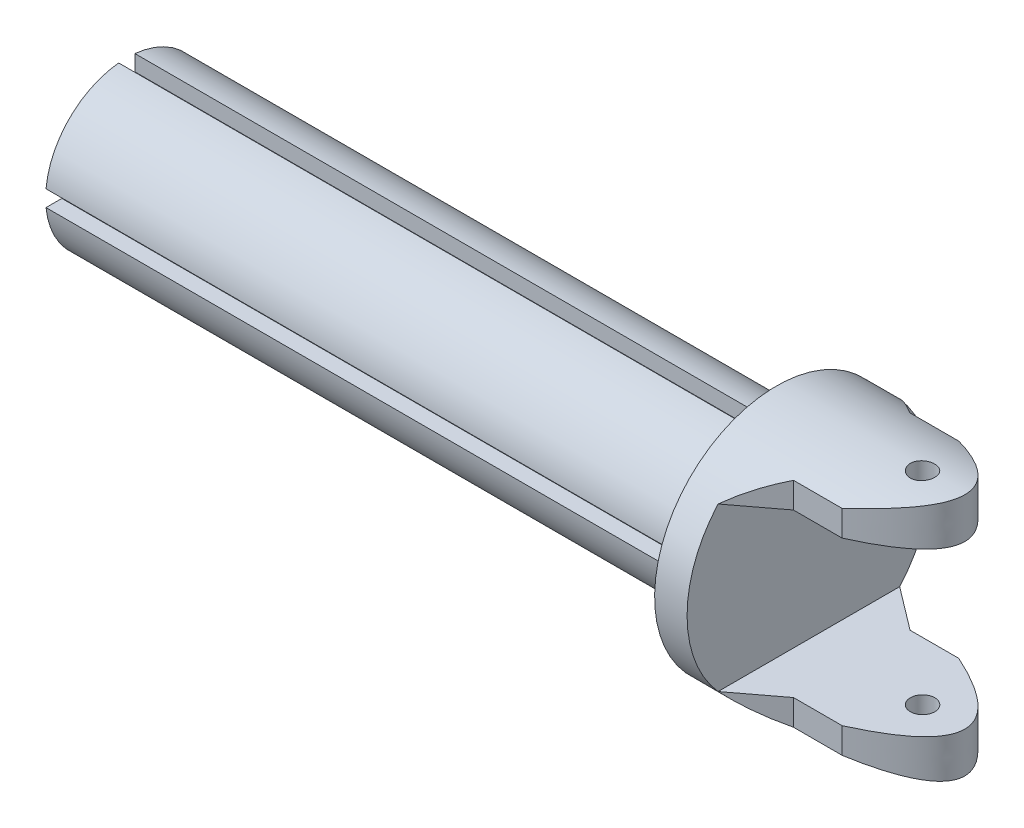
from build123d import *

# Parameters (mm, degrees)
BOSS_EXTRUDE1_DEPTH     = 40
SKETCH2_R               = 7.5
BOSS_EXTRUDE2_DEPTH     = 2
BOSS_EXTRUDE3_DEPTH     = 10
CUT_EXTRUDE1_DEPTH      = 55.004629431
CUT_EXTRUDE1_DEPTH_BACK = 55.004629431
CUT_EXTRUDE2_DEPTH      = 54.619586107
CUT_EXTRUDE2_DEPTH_BACK = 54.619586107
SKETCH5_R               = 0.75


with BuildPart() as part:
    # Sketch1 → Boss-Extrude1 (new body)
    with BuildSketch(Plane(origin=(0, 0, 0), x_dir=(0, 0, -1), z_dir=(1, 0, 0))):
        with BuildLine():
            Line((-0.5, 4), (0.5, 4))
            Line((0.5, 4), (0.5, 4.974937186))
            ThreePointArc((0.5, 4.974937186), (3.535533906, 3.535533906), (4.974937186, 0.5))
            Line((4.974937186, 0.5), (4, 0.5))
            Line((4, 0.5), (4, -0.5))
            Line((4, -0.5), (4.974937186, -0.5))
            ThreePointArc((4.974937186, -0.5), (3.535533906, -3.535533906), (0.5, -4.974937186))
            Line((0.5, -4.974937186), (0.5, -4))
            Line((0.5, -4), (-0.5, -4))
            Line((-0.5, -4), (-0.5, -4.974937186))
            ThreePointArc((-0.5, -4.974937186), (-3.535533906, -3.535533906), (-4.974937186, -0.5))
            Line((-4.974937186, -0.5), (-4, -0.5))
            Line((-4, -0.5), (-4, 0.5))
            Line((-4, 0.5), (-4.974937186, 0.5))
            ThreePointArc((-4.974937186, 0.5), (-3.535533906, 3.535533906), (-0.5, 4.974937186))
            Line((-0.5, 4.974937186), (-0.5, 4))
        make_face()
    extrude(amount=BOSS_EXTRUDE1_DEPTH)

    # Sketch2 → Boss-Extrude2 (add)
    with BuildSketch(Plane(origin=(40, 0, 0), x_dir=(0, 0, -1), z_dir=(1, 0, 0))):
        Circle(SKETCH2_R)
    extrude(amount=BOSS_EXTRUDE2_DEPTH)

    # Sketch3 → Boss-Extrude3 (add)
    with BuildSketch(Plane(origin=(42, 0, 0), x_dir=(0, 0, -1), z_dir=(1, 0, 0))):
        with BuildLine():
            ThreePointArc((5.590169944, 5), (0, 7.5), (-5.590169944, 5))
            Line((-5.590169944, 5), (-4.898979486, 5))
            Line((-4.898979486, 5), (4.898979486, 5))
            Line((4.898979486, 5), (5.590169944, 5))
        make_face()
        with BuildLine():
            Line((-4.898979486, -5), (-5.590169944, -5))
            ThreePointArc((-5.590169944, -5), (0, -7.5), (5.590169944, -5))
            Line((5.590169944, -5), (4.898979486, -5))
            Line((4.898979486, -5), (-4.898979486, -5))
        make_face()
    extrude(amount=BOSS_EXTRUDE3_DEPTH)

    # Sketch4 → Cut-Extrude1 (cut, two sides: drawn at the far end of the back side and taken through both)
    with BuildSketch(Plane.XZ.offset(-5).offset(-CUT_EXTRUDE1_DEPTH_BACK)):
        with BuildLine():
            Line((42, 5.590169944), (52, 5.590169944))
            Line((52, 5.590169944), (52, -5.590169944))
            Line((52, -5.590169944), (42, -5.590169944))
            Line((42, -5.590169944), (44.640400827, -3.590169944))
            Line((44.640400827, -3.590169944), (47.640400827, -3.590169944))
            add(Edge.make_bspline(
                [(47.640400827, -3.590169944), (50.280133609, -2.393446629), (52.919866391, 0), (50.280133609, 2.393446629), (47.640400827, 3.590169944)],
                knots=[0.178885438, 0.178885438, 0.178885438, 0.178885438, 0.5, 0.821114562, 0.821114562, 0.821114562, 0.821114562], degree=3))
            Line((47.640400827, 3.590169944), (44.640400827, 3.590169944))
            Line((44.640400827, 3.590169944), (42, 5.590169944))
        make_face()
    extrude(amount=CUT_EXTRUDE1_DEPTH + CUT_EXTRUDE1_DEPTH_BACK, mode=Mode.SUBTRACT)

    # Sketch5 → Cut-Extrude2 (cut, two sides: drawn at the far end of the back side and taken through both)
    with BuildSketch(Plane.XZ.offset(-5).offset(-CUT_EXTRUDE2_DEPTH_BACK)):
        with Locations(Location((49, 0, 0), (0, 0, 270))):
            Circle(SKETCH5_R)
    extrude(amount=CUT_EXTRUDE2_DEPTH + CUT_EXTRUDE2_DEPTH_BACK, mode=Mode.SUBTRACT)


solid = part.part
